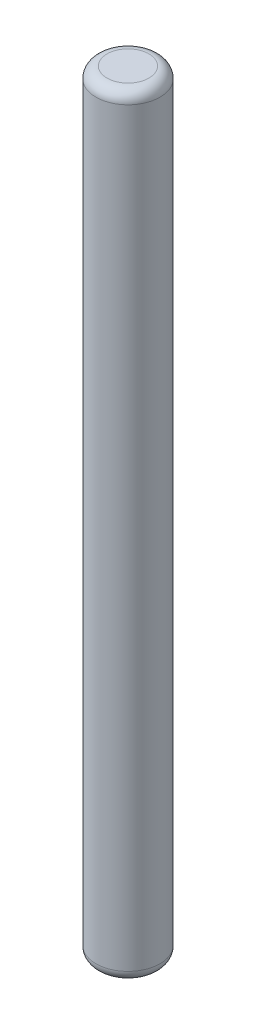
from build123d import *

# Parameters (mm, degrees)
SKIZZE1_R                       = 1.45
AUFSATZ_LINEAR_AUSTRAGEN1_DEPTH = 35
VERRUNDUNG1_R                   = 0.5


with BuildPart() as part:
    # Skizze1 → Aufsatz-Linear austragen1 (new body)
    with BuildSketch(Plane(origin=(0, 0, 0), x_dir=(1, 0, 0), z_dir=(0, 1, 0))):
        with Locations(Location((0, 0, 0), (0, 0, 270))):
            Circle(SKIZZE1_R)
    extrude(amount=AUFSATZ_LINEAR_AUSTRAGEN1_DEPTH)

    # Verrundung1
    verrundung1_edges = [part.edges().sort_by_distance(p)[0] for p in [
        (0, 0, -1.45),
        (0, 35, -1.45),
    ]]
    fillet(verrundung1_edges, radius=VERRUNDUNG1_R)


solid = part.part
